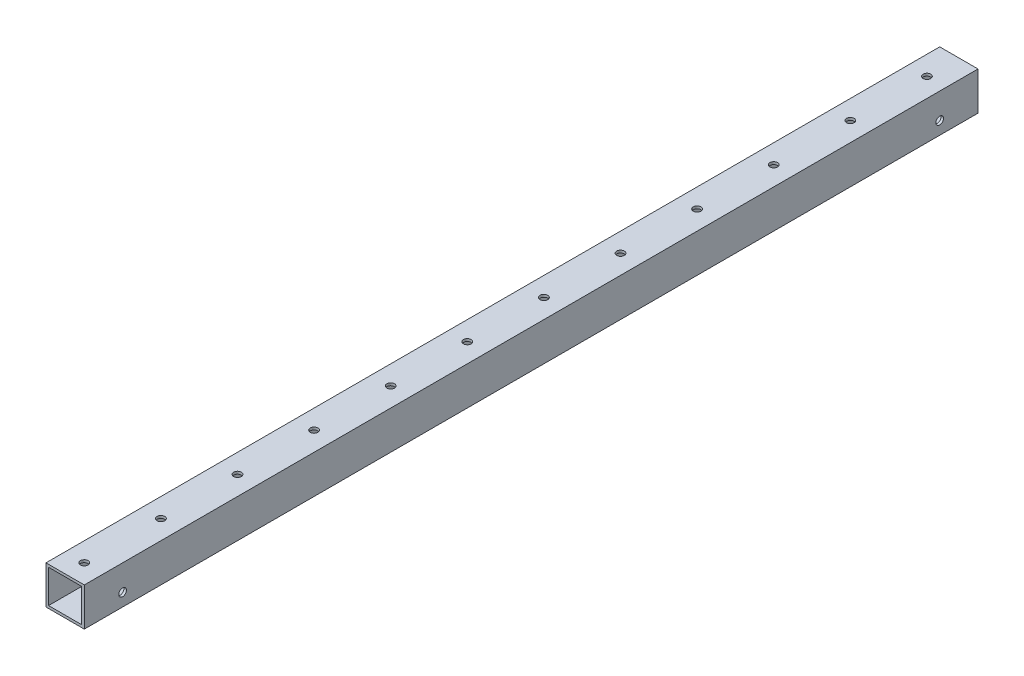
from build123d import *

# Parameters (mm, degrees)
SKETCH_1_W             = 15
SKETCH_1_H             = 15
SKETCH_1_W_2           = 13
SKETCH_1_H_2           = 13
EXTRUDE_1_DEPTH        = 175
SKETCH_2_R             = 1.5
CUT_EXTRUDE_1_DEPTH    = 30
SKETCH_3_R             = 1.5
CUT_EXTRUDE_2_DEPTH    = 5
PATTERN_LINEAR_1_COUNT = 12
PATTERN_LINEAR_1_PITCH = 30


with BuildPart() as part:
    # 草图1 → 凸台-拉伸1 (new, symmetric)
    with BuildSketch(Plane.XY):
        Rectangle(SKETCH_1_W, SKETCH_1_H)
        Rectangle(SKETCH_1_W_2, SKETCH_1_H_2, mode=Mode.SUBTRACT)
    extrude(amount=EXTRUDE_1_DEPTH, both=True)

    # 草图2 → 切除-拉伸1 (cut, symmetric)
    with BuildSketch(Plane.ZY.offset(7.5)):
        with Locations((-160, -2.5)):
            Circle(SKETCH_2_R)
        with Locations((160, -2.5)):
            Circle(SKETCH_2_R)
    extrude(amount=CUT_EXTRUDE_1_DEPTH, both=True, mode=Mode.SUBTRACT)

    # 草图3 → 切除-拉伸2 (cut)
    with BuildSketch(Plane(origin=(0, 7.5, 0), x_dir=(1, 0, 0), z_dir=(0, 1, 0))):
        with Locations(Location((0, -167.5, 0), (0, 0, 270))):
            Circle(SKETCH_3_R)
    cut_extrude_2 = extrude(amount=-CUT_EXTRUDE_2_DEPTH, mode=Mode.SUBTRACT)

    # 阵列(线性)1: 切除-拉伸2 ×12
    with Locations(*[(0, 0, -i * PATTERN_LINEAR_1_PITCH) for i in range(1, PATTERN_LINEAR_1_COUNT)]):
        add(cut_extrude_2, mode=Mode.SUBTRACT)


solid = part.part
